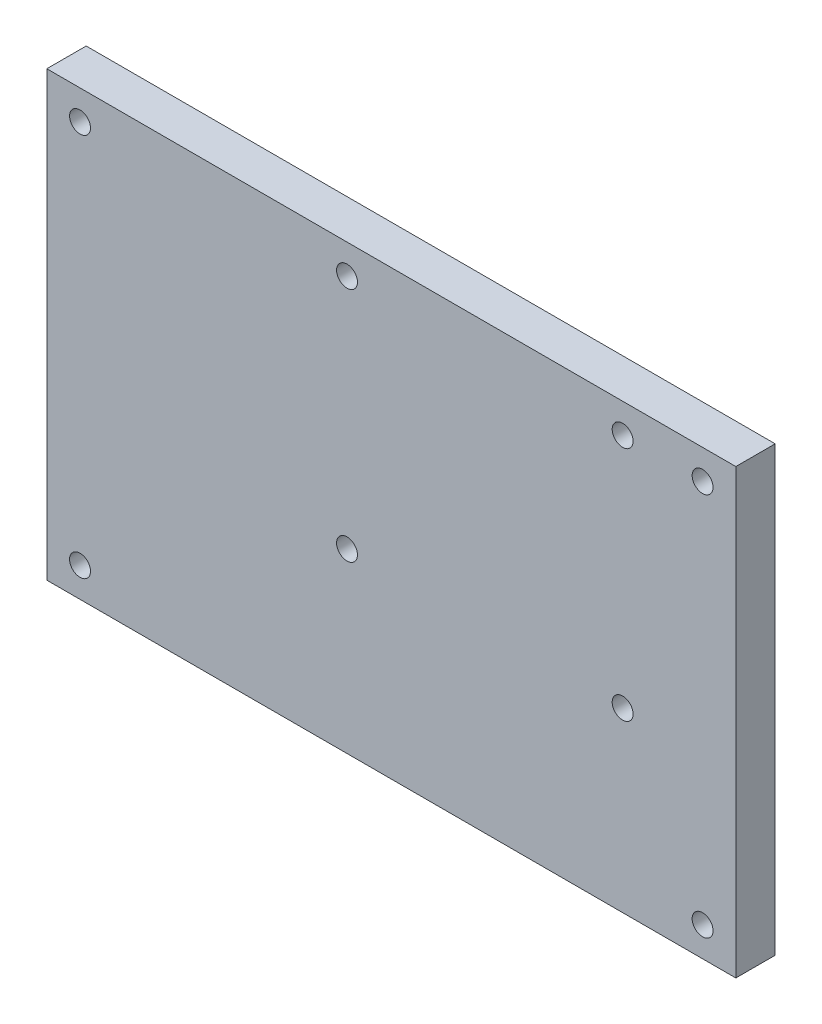
from build123d import *

# Parameters (mm, degrees)
SKETCH1_W           = 444.5
SKETCH1_H           = 285.75
BOSS_EXTRUDE1_DEPTH = 25.4
SKETCH2_R           = 6.7437
CUT_EXTRUDE1_DEPTH  = 530.035417056
SKETCH3_R           = 9.525
CUT_EXTRUDE2_DEPTH  = 7.62
SKETCH4_R           = 6.7437
CUT_EXTRUDE3_DEPTH  = 530.035417056


with BuildPart() as part:
    # Sketch1 → Boss-Extrude1 (new body)
    with BuildSketch(Plane.XY):
        with Locations((222.25, 142.875)):
            Rectangle(SKETCH1_W, SKETCH1_H)
    extrude(amount=BOSS_EXTRUDE1_DEPTH)

    # Sketch2 → Cut-Extrude1 (cut, through all)
    with BuildSketch(Plane.XY):
        with Locations((21.4376, 266.7)):
            Circle(SKETCH2_R)
        with Locations((423.0624, 266.7)):
            Circle(SKETCH2_R)
        with Locations((21.4376, 19.05)):
            Circle(SKETCH2_R)
        with Locations((423.0624, 19.05)):
            Circle(SKETCH2_R)
    extrude(amount=CUT_EXTRUDE1_DEPTH, mode=Mode.SUBTRACT)

    # Sketch3 → Cut-Extrude2 (cut)
    with BuildSketch(Plane.XY):
        with Locations(Location((21.4376, 266.7, 0), (0, 0, 180))):
            Circle(SKETCH3_R)
        with Locations(Location((423.0624, 266.7, 0), (0, 0, 180))):
            Circle(SKETCH3_R)
        with Locations(Location((21.4376, 19.05, 0), (0, 0, 180))):
            Circle(SKETCH3_R)
        with Locations(Location((423.0624, 19.05, 0), (0, 0, 180))):
            Circle(SKETCH3_R)
    extrude(amount=CUT_EXTRUDE2_DEPTH, mode=Mode.SUBTRACT)

    # Sketch4 → Cut-Extrude3 (cut, through all)
    with BuildSketch(Plane.XY):
        with Locations((193.675, 114.3)):
            Circle(SKETCH4_R)
        with Locations((371.475, 114.3)):
            Circle(SKETCH4_R)
        with Locations((193.675, 266.7)):
            Circle(SKETCH4_R)
        with Locations((371.475, 266.7)):
            Circle(SKETCH4_R)
    extrude(amount=CUT_EXTRUDE3_DEPTH, mode=Mode.SUBTRACT)


solid = part.part
